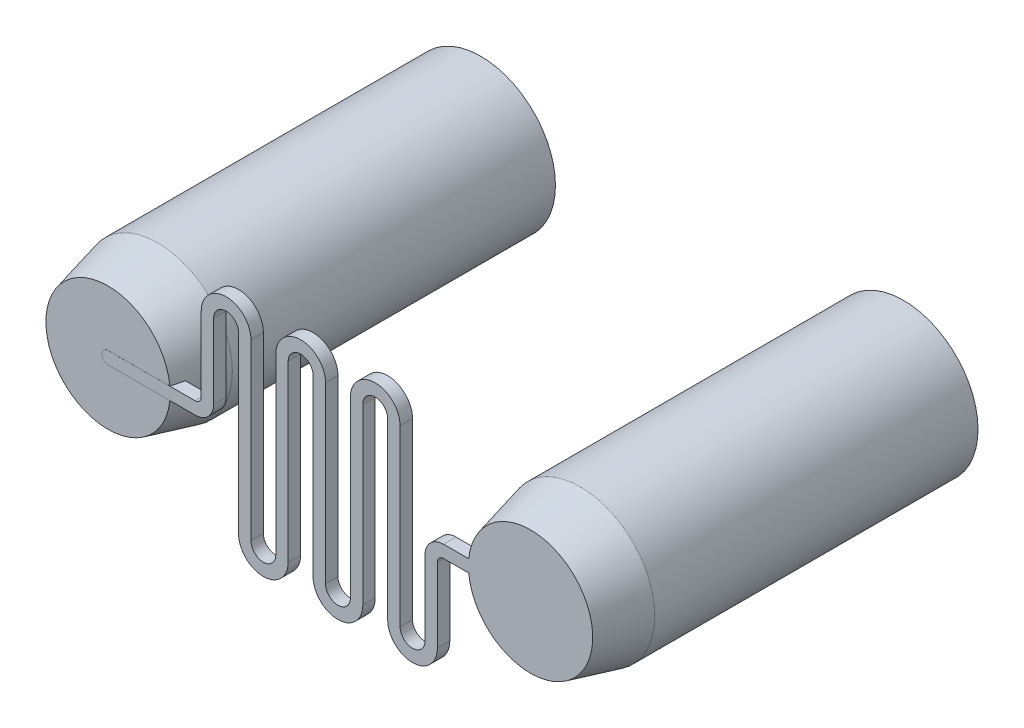
from build123d import *

# Parameters (mm, degrees)
BOSS_EXTRUDE1_DEPTH = 1
SKETCH5_R           = 5
CUT_EXTRUDE1_DEPTH  = 26


with BuildPart() as part:
    # Sketch2 → Boss-Extrude1 (new body)
    with BuildSketch(Plane.XY):
        with BuildLine():
            Line((-20.5, -0.5), (-13.5, -0.5))
            ThreePointArc((-13.5, -0.5), (-12.439339828, -0.060660172), (-12, 1))
            Line((-12, 1), (-12, 7))
            ThreePointArc((-12, 7), (-11, 8), (-10, 7))
            Line((-10, 7), (-10, 0))
            Line((-10, 0), (-10, -7))
            ThreePointArc((-10, -7), (-8, -9), (-6, -7))
            Line((-6, -7), (-6, 0))
            Line((-6, 0), (-6, 7))
            ThreePointArc((-6, 7), (-5, 8), (-4, 7))
            Line((-4, 7), (-4, 0))
            Line((-4, 0), (-4, -7))
            ThreePointArc((-4, -7), (-2, -9), (0, -7))
            Line((0, -7), (0, 0))
            Line((0, 0), (0, 7))
            ThreePointArc((0, 7), (1, 8), (2, 7))
            Line((2, 7), (2, 0))
            Line((2, 0), (2, -7))
            ThreePointArc((2, -7), (4, -9), (6, -7))
            Line((6, -7), (6, -1))
            ThreePointArc((6, -1), (6.146446609, -0.646446609), (6.5, -0.5))
            Line((6.5, -0.5), (13.5, -0.5))
            ThreePointArc((13.5, -0.5), (14, 0), (13.5, 0.5))
            Line((13.5, 0.5), (6.5, 0.5))
            ThreePointArc((6.5, 0.5), (5.439339828, 0.060660172), (5, -1))
            Line((5, -1), (5, -7))
            ThreePointArc((5, -7), (4, -8), (3, -7))
            Line((3, -7), (3, 0))
            Line((3, 0), (3, 7))
            ThreePointArc((3, 7), (1, 9), (-1, 7))
            Line((-1, 7), (-1, 0))
            Line((-1, 0), (-1, -7))
            ThreePointArc((-1, -7), (-2, -8), (-3, -7))
            Line((-3, -7), (-3, 0))
            Line((-3, 0), (-3, 7))
            ThreePointArc((-3, 7), (-5, 9), (-7, 7))
            Line((-7, 7), (-7, 0))
            Line((-7, 0), (-7, -7))
            ThreePointArc((-7, -7), (-8, -8), (-9, -7))
            Line((-9, -7), (-9, 0))
            Line((-9, 0), (-9, 7))
            ThreePointArc((-9, 7), (-11, 9), (-13, 7))
            Line((-13, 7), (-13, 1))
            ThreePointArc((-13, 1), (-13.146446609, 0.646446609), (-13.5, 0.5))
            Line((-13.5, 0.5), (-20.5, 0.5))
            ThreePointArc((-20.5, 0.5), (-21, 0), (-20.5, -0.5))
        make_face()
    extrude(amount=BOSS_EXTRUDE1_DEPTH)

    # Sketch3 → Revolve1 (revolve)
    with BuildSketch(Plane(origin=(0, 0, 0), x_dir=(1, 0, 0), z_dir=(0, 1, 0)), mode=Mode.PRIVATE) as revolve1_sk:
        Polygon((-20.5, -0.998367727), (-25.5, -0.998367727), (-26.5, 3.001632273), (-26.5, 29.001632273), (-20.5, 29.001632273), align=None)
    revolve(revolve1_sk.sketch.rotate(Axis((-20.5, 0, 0.998367727), (0, 0, -1)), 174.260829523), axis=Axis((-20.5, 0, 0.998367727), (0, 0, -1)))

    # Sketch4 → Revolve2 (revolve)
    with BuildSketch(Plane(origin=(0, 0, 0), x_dir=(1, 0, 0), z_dir=(0, 1, 0)), mode=Mode.PRIVATE) as revolve2_sk:
        Polygon((13.5, -1), (18.5, -1), (19.5, 3), (19.5, 29), (13.5, 29), align=None)
    revolve(revolve2_sk.sketch.rotate(Axis((13.5, 0, 1), (0, 0, -1)), 174.534976284), axis=Axis((13.5, 0, 1), (0, 0, -1)))

    # Sketch5 → Cut-Extrude1 (cut)
    with BuildSketch(Plane(origin=(0, 0, -29.001632273), x_dir=(-1, 0, 0), z_dir=(0, 0, -1))):
        with Locations((20.5, 0)):
            Circle(SKETCH5_R)
        with Locations((-13.5, 0)):
            Circle(SKETCH5_R)
    extrude(amount=-CUT_EXTRUDE1_DEPTH, mode=Mode.SUBTRACT)


solid = part.part
